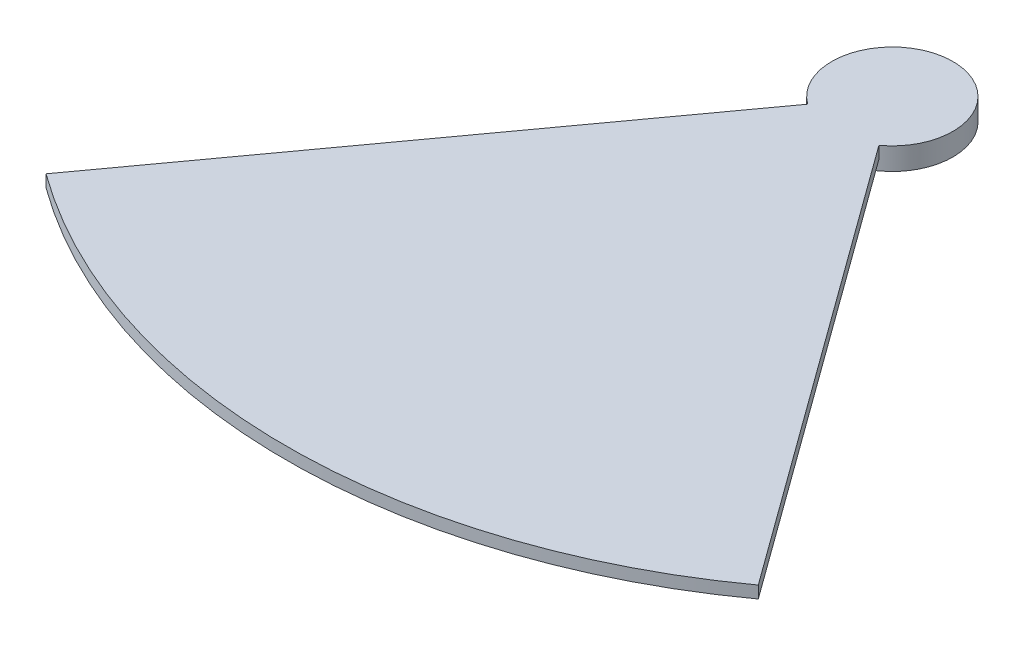
from build123d import *

# Parameters (mm, degrees)
SKETCH1_R           = 6
SKETCH1_R_2         = 3.175
BOSS_EXTRUDE1_DEPTH = 16
SKETCH2_R           = 30
BOSS_EXTRUDE2_DEPTH = 5
BOSS_EXTRUDE3_DEPTH = 6


with BuildPart() as part:
    # Sketch1 → Boss-Extrude1 (new body)
    with BuildSketch(Plane(origin=(0, 0, 0), x_dir=(1, 0, 0), z_dir=(0, 1, 0))):
        with Locations(Location((0, 0, 0), (0, 0, 270))):
            Circle(SKETCH1_R)
        with Locations(Location((0, 0, 0), (0, 0, 270))):
            Circle(SKETCH1_R_2, mode=Mode.SUBTRACT)
    extrude(amount=BOSS_EXTRUDE1_DEPTH)

    # Sketch2 → Boss-Extrude2 (add)
    with BuildSketch(Plane(origin=(0, 16, 0), x_dir=(1, 0, 0), z_dir=(0, 1, 0))):
        with Locations(Location((0, 0, 0), (0, 0, 270))):
            Circle(SKETCH2_R)
    extrude(amount=BOSS_EXTRUDE2_DEPTH)

    # Sketch3 → Boss-Extrude3 (add)
    with BuildSketch(Plane(origin=(0, 21, 0), x_dir=(1, 0, 0), z_dir=(0, 1, 0))):
        with BuildLine():
            Line((17.633557569, -24.270509831), (176.335575688, -242.705098312))
            ThreePointArc((176.335575688, -242.705098312), (0, -300), (-176.335575688, -242.705098312))
            Line((-176.335575688, -242.705098312), (-17.633557569, -24.270509831))
            ThreePointArc((-17.633557569, -24.270509831), (0, 30), (17.633557569, -24.270509831))
        make_face()
    extrude(amount=BOSS_EXTRUDE3_DEPTH)


solid = part.part
